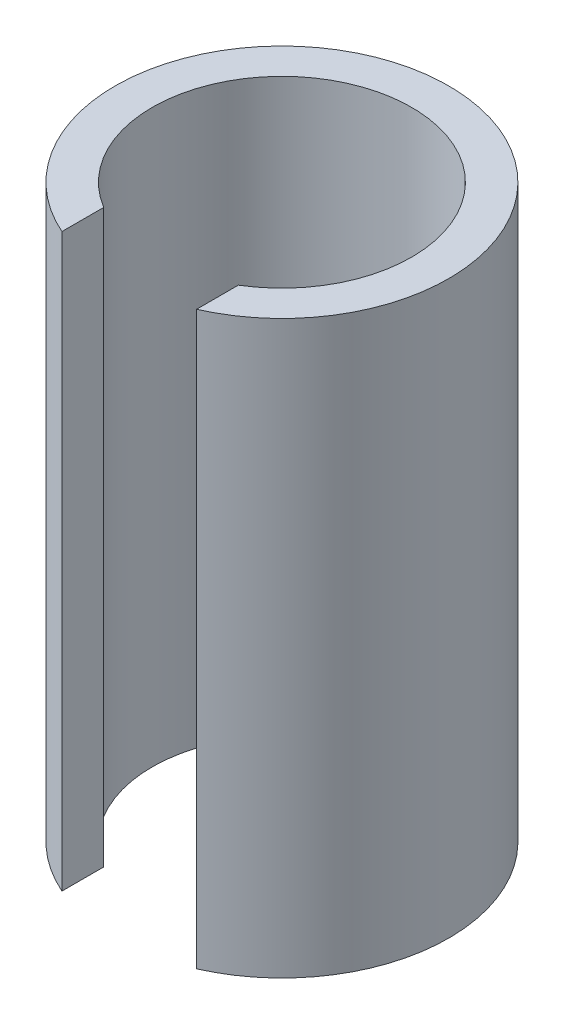
from build123d import *

# Parameters (mm, degrees)
ESQUISSE1_R   = 20.45
ESQUISSE1_R_2 = 15.9
TUBE_DEPTH    = 70
ESQUISSE2_W   = 16.5
ESQUISSE2_H   = 10.294768252
FENTE_DEPTH   = 76.739058616


with BuildPart() as part:
    # Esquisse1 → Tube (new body)
    with BuildSketch(Plane(origin=(0, 0, 0), x_dir=(1, 0, 0), z_dir=(0, 1, 0))):
        with Locations(Location((0, 0, 0), (0, 0, 270))):
            Circle(ESQUISSE1_R)
        with Locations(Location((0, 0, 0), (0, 0, 270))):
            Circle(ESQUISSE1_R_2, mode=Mode.SUBTRACT)
    extrude(amount=TUBE_DEPTH)

    # Esquisse2 → Fente (cut, through all)
    with BuildSketch(Plane(origin=(0, 70, 0), x_dir=(1, 0, 0), z_dir=(0, 1, 0))):
        with Locations((0, -16.768797771)):
            Rectangle(ESQUISSE2_W, ESQUISSE2_H)
    extrude(amount=-FENTE_DEPTH, mode=Mode.SUBTRACT)


solid = part.part
